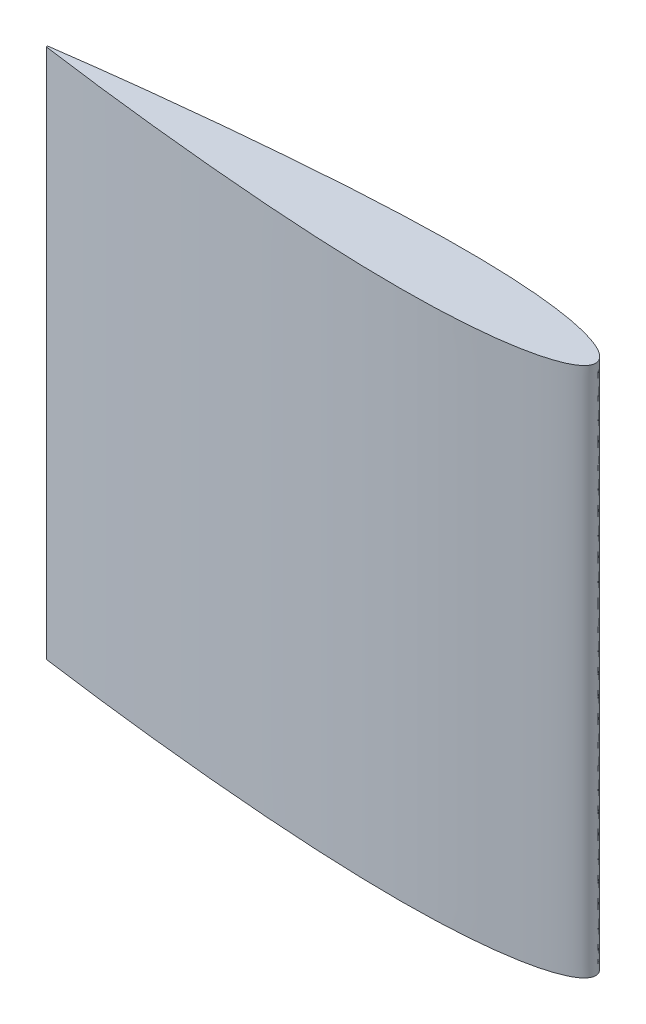
from build123d import *

# Parameters (mm, degrees)
BOSS_EXTRUDE1_DEPTH = 145


with BuildPart() as part:
    # Sketch3 → Boss-Extrude1 (new body)
    with BuildSketch(Plane(origin=(0, 0, 0), x_dir=(1, 0, 0), z_dir=(0, 1, 0))):
        with BuildLine():
            Line((-600, 0.811), (-600, 1.189))
            add(Edge.make_bspline(
                [(-600, 0.811), (-597.138302043, 0.409042638), (-586.355085788, -1.048676689), (-571.339128807, -2.835594096), (-553.404813848, -4.684676434), (-539.806277562, -5.899060812), (-526.805037999, -6.852178502), (-516.02794186, -7.478766055), (-505.438137762, -7.8938933), (-495.257183985, -8.051653695), (-486.642305752, -7.930136743), (-479.599508854, -7.610634084), (-474.074443319, -7.200056736), (-469.023705266, -6.651589941), (-465.13938082, -6.070513375), (-462.307824515, -5.534139238), (-460.39553393, -5.115381377), (-458.633849165, -4.669207566), (-457.026662994, -4.197616589), (-455.577519259, -3.702174599), (-454.289508338, -3.184592743), (-453.165179909, -2.646364146), (-452.206675963, -2.088609374), (-451.415112638, -1.512273932), (-450.792019449, -0.916409779), (-450.338899004, -0.299328933), (-450.061860448, 0.341984826), (-449.969846627, 1), (-450.061860448, 1.658015174), (-450.338899004, 2.299328933), (-450.792019449, 2.916409779), (-451.415112638, 3.512273932), (-452.206675963, 4.088609374), (-453.165179909, 4.646364146), (-454.289508338, 5.184592743), (-455.577519259, 5.702174599), (-457.026662994, 6.197616589), (-458.633849165, 6.669207566), (-460.39553393, 7.115381377), (-463.034093701, 7.693179362), (-466.690879156, 8.328596007), (-471.486795968, 8.942466147), (-477.788242844, 9.514270286), (-485.698184542, 9.916410793), (-496.430894505, 10.068236582), (-507.815667127, 9.832811333), (-519.610575518, 9.290938121), (-530.399973737, 8.60498896), (-542.196364921, 7.689172356), (-552.533079604, 6.749343829), (-565.855225929, 5.413669725), (-579.031667881, 3.940059796), (-591.610591196, 2.342168498), (-597.89270141, 1.483982009), (-599.737670609, 1.225847086), (-600, 1.189)],
                knots=[0, 0, 0, 0, 0.028342901, 0.106722049, 0.148306055, 0.205171367, 0.2406214, 0.276160573, 0.311047092, 0.344559266, 0.37601757, 0.395537659, 0.413698812, 0.430349273, 0.445356904, 0.452209372, 0.458611567, 0.464554044, 0.47002985, 0.475034902, 0.479569141, 0.483636857, 0.487250263, 0.490431338, 0.493218828, 0.495674086, 0.497891368, 0.5, 0.502108632, 0.504325914, 0.506781172, 0.509568662, 0.512749737, 0.516363143, 0.520430859, 0.524965098, 0.52997015, 0.535445956, 0.541388433, 0.547790628, 0.561933981, 0.577778559, 0.595202024, 0.62398243, 0.655440734, 0.700464146, 0.735649713, 0.771241831, 0.806495957, 0.851693945, 0.873039495, 0.937813387, 0.981728388, 0.997401831, 1, 1, 1, 1], degree=3))
        make_face()
    extrude(amount=BOSS_EXTRUDE1_DEPTH)


solid = part.part
